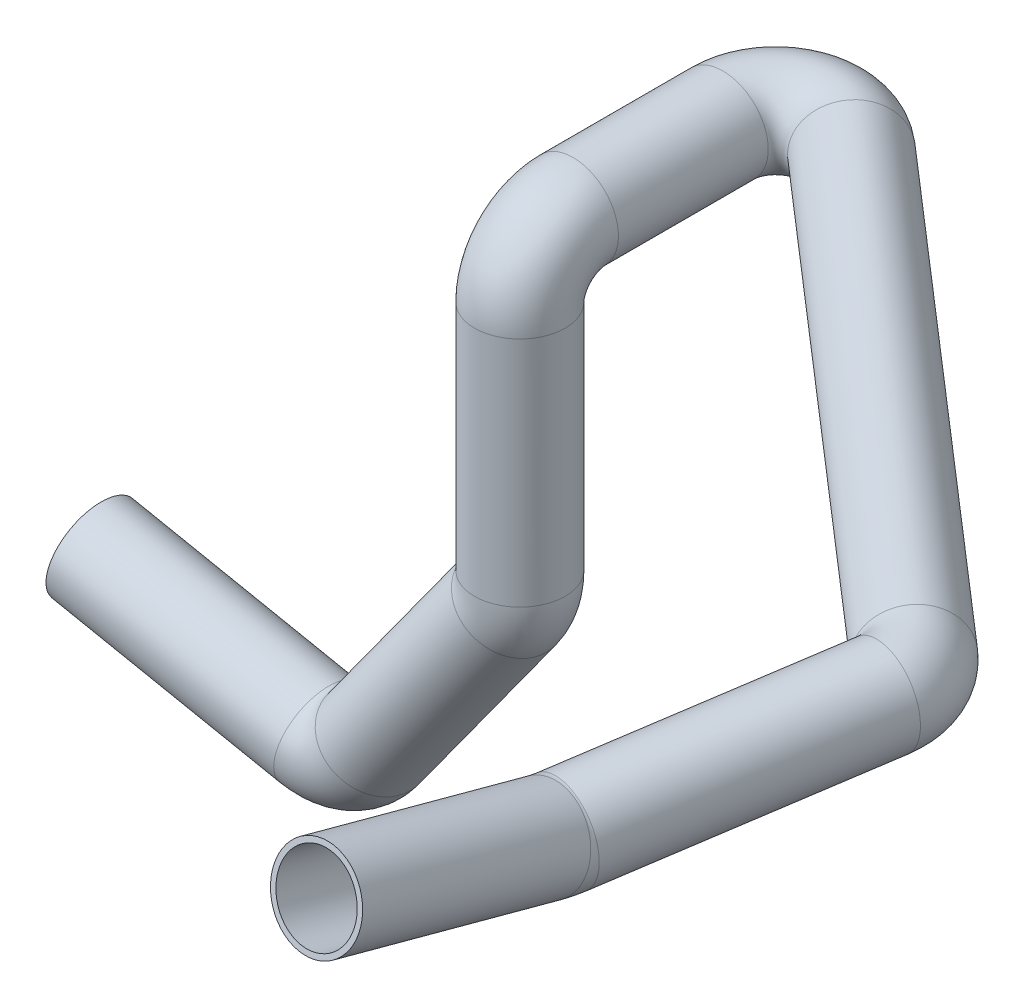
from build123d import *

# Parameters (mm, degrees)
SWEEP_THIN1_PROFILE_R   = 17
SWEEP_THIN1_PROFILE_R_2 = 15


with BuildPart() as part:
    # Sweep-Thin1: sweep along a curve in space
    with BuildLine() as sweep_thin1_path:
        Line((0, 0, 0), (85.461438973, -17.118208641, 0))
        ThreePointArc((105.585882461, -9.241305733, 0), (96.679169603, -16.131929323, 0), (85.461438973, -17.118208641, 0))
        Line((105.585882461, -9.241305733, 0), (156.720173902, 61.3418003, 0))
        ThreePointArc((156.720173902, 61.3418003, 0), (159.549124102, 66.908034377, 0), (160.523772128, 73.075366236, 0))
        Line((160.523772128, 73.075366236, 0), (160.523772128, 160.234362435, 0))
        ThreePointArc((160.523772128, 180.234362435, -20), (160.523772128, 174.376498058, -5.857864376), (160.523772128, 160.234362435, 0))
        Line((160.523772128, 180.234362435, -20), (160.523772128, 180.234362435, -76.242023657))
        ThreePointArc((193.610363482, 179.947164947, -91.365135171), (172.209390479, 180.132929193, -94.432086272), (160.523772128, 180.234362435, -76.242023657))
        Line((193.610363482, 179.947164947, -91.365135171), (367.850155379, 178.434732618, 59.431084216))
        ThreePointArc((374.510110602, 178.282856784, 77.715264739), (373.553938417, 178.360120784, 67.708534336), (367.850155379, 178.434732618, 59.431084216))
        Line((374.510110602, 178.282856784, 77.715264739), (357.866690044, 177.538214036, 181.652657468))
        ThreePointArc((357.350115971, 178.268500838, 187.505509716), (357.501498599, 177.71126787, 184.593616067), (357.866690044, 177.538214036, 181.652657468))
        Line((357.350115971, 178.268500838, 187.505509716), (356.089704324, 200.149000262, 271.863945724))
    # Sweep-Thin1 profile (on start of the path) → Sweep-Thin1 (sweep)
    with BuildSketch(Plane(origin=(0, 0, 0), x_dir=(0.19640208570075895, 0.9805234422146121, 0), z_dir=(0.9805234422146121, -0.19640208570075895, 0))):
        Circle(SWEEP_THIN1_PROFILE_R)
        Circle(SWEEP_THIN1_PROFILE_R_2, mode=Mode.SUBTRACT)
    sweep(path=sweep_thin1_path.line)


solid = part.part
